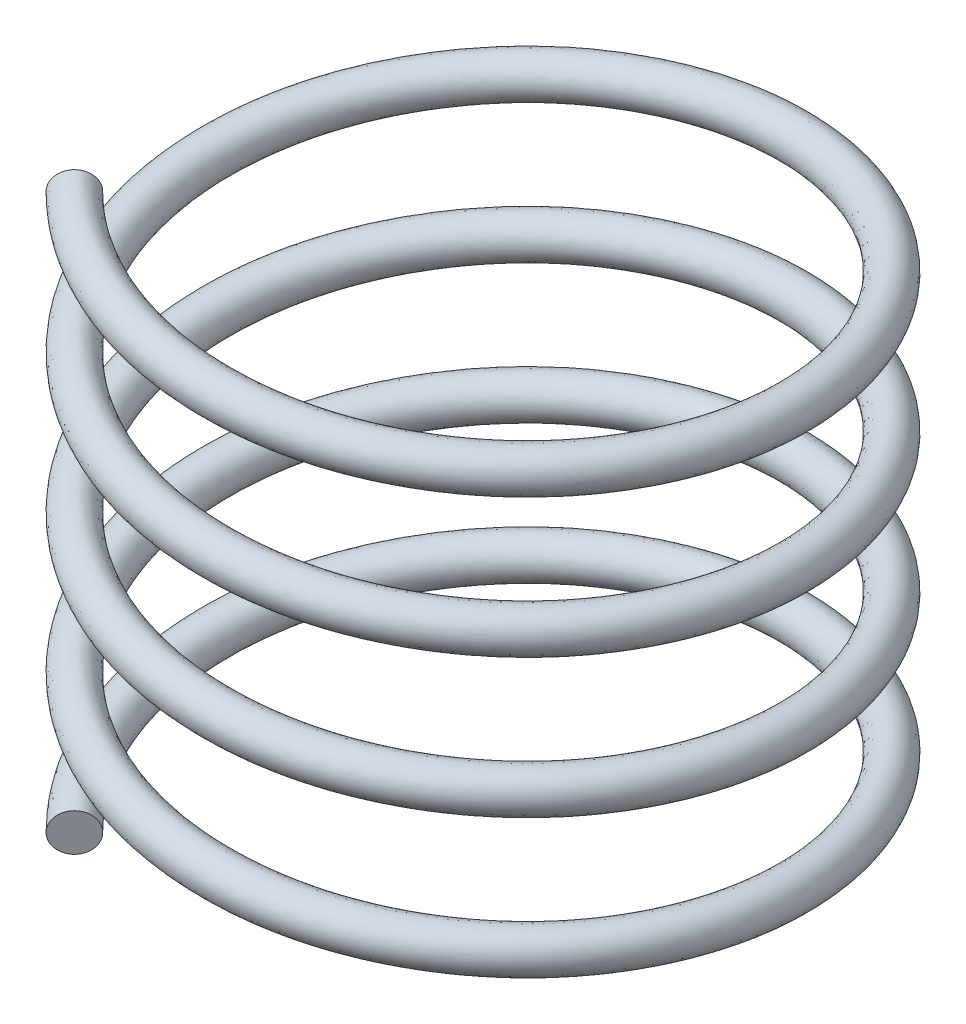
from build123d import *

# Parameters (mm, degrees)
SWEEP1_PITCH       = 2.25
SWEEP1_HEIGHT      = 9
SWEEP1_RADIUS      = 4.675
SWEEP1_START_ANGLE = -45
SKETCH4_R          = 0.325


with BuildPart() as part:
    # Sweep1: sweep along a helix
    with BuildLine() as sweep1_path:
        add(Helix(SWEEP1_PITCH, SWEEP1_HEIGHT, SWEEP1_RADIUS, center=(0, 0, 0), direction=(0, 1, 0), lefthand=True, mode=Mode.PRIVATE).rotate(Axis((0, 0, 0), (0, 1, 0)), SWEEP1_START_ANGLE))
    # Sketch4 → Sweep1 (sweep)
    with BuildSketch(Plane(origin=(-3.305724202, 0, 3.305724202), x_dir=(-0.6980260214538225, 0.10078733494589155, 0.7089439939006836), z_dir=(-0.7050414434643476, 0.07637490422541598, -0.7050414434643313))):
        with Locations((0.00928562, 0.003561064)):
            Circle(SKETCH4_R)
    sweep(path=sweep1_path.line, is_frenet=True)


solid = part.part
